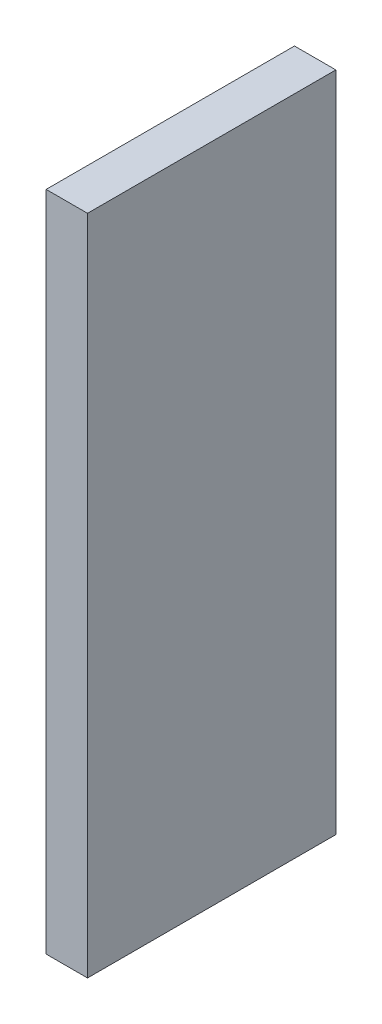
from build123d import *

# Parameters (mm, degrees)
SKETCH1_W           = 76.2
SKETCH1_H           = 203.2
BOSS_EXTRUDE1_DEPTH = 12.7


with BuildPart() as part:
    # Sketch1 → Boss-Extrude1 (new body)
    with BuildSketch(Plane(origin=(0, 0, 0), x_dir=(0, 0, -1), z_dir=(1, 0, 0))):
        Rectangle(SKETCH1_W, SKETCH1_H)
    extrude(amount=BOSS_EXTRUDE1_DEPTH)


solid = part.part
